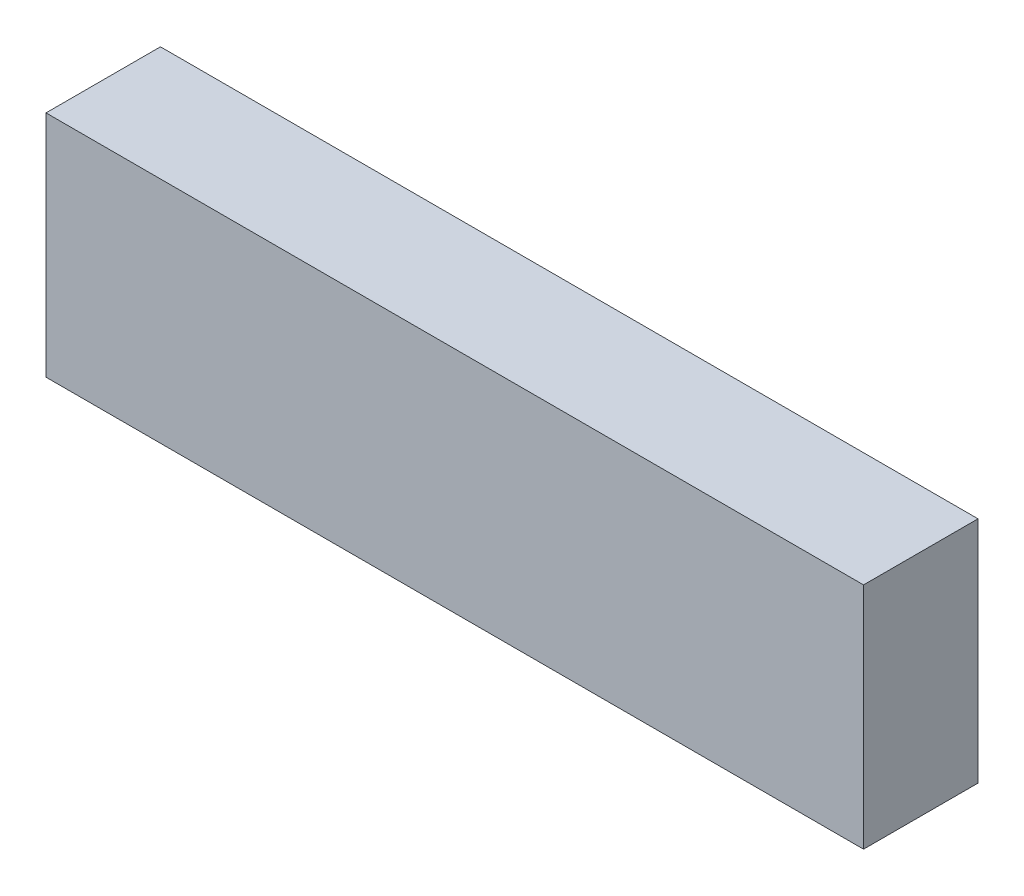
from build123d import *

# Parameters (mm, degrees)
ESQUISSE1_W        = 250
ESQUISSE1_H        = 35
BOSS_EXTRU_1_DEPTH = 70


with BuildPart() as part:
    # Esquisse1 → Boss.-Extru.1 (new body)
    with BuildSketch(Plane(origin=(0, 0, 0), x_dir=(1, 0, 0), z_dir=(0, 1, 0))):
        Rectangle(ESQUISSE1_W, ESQUISSE1_H)
    extrude(amount=BOSS_EXTRU_1_DEPTH)


solid = part.part
